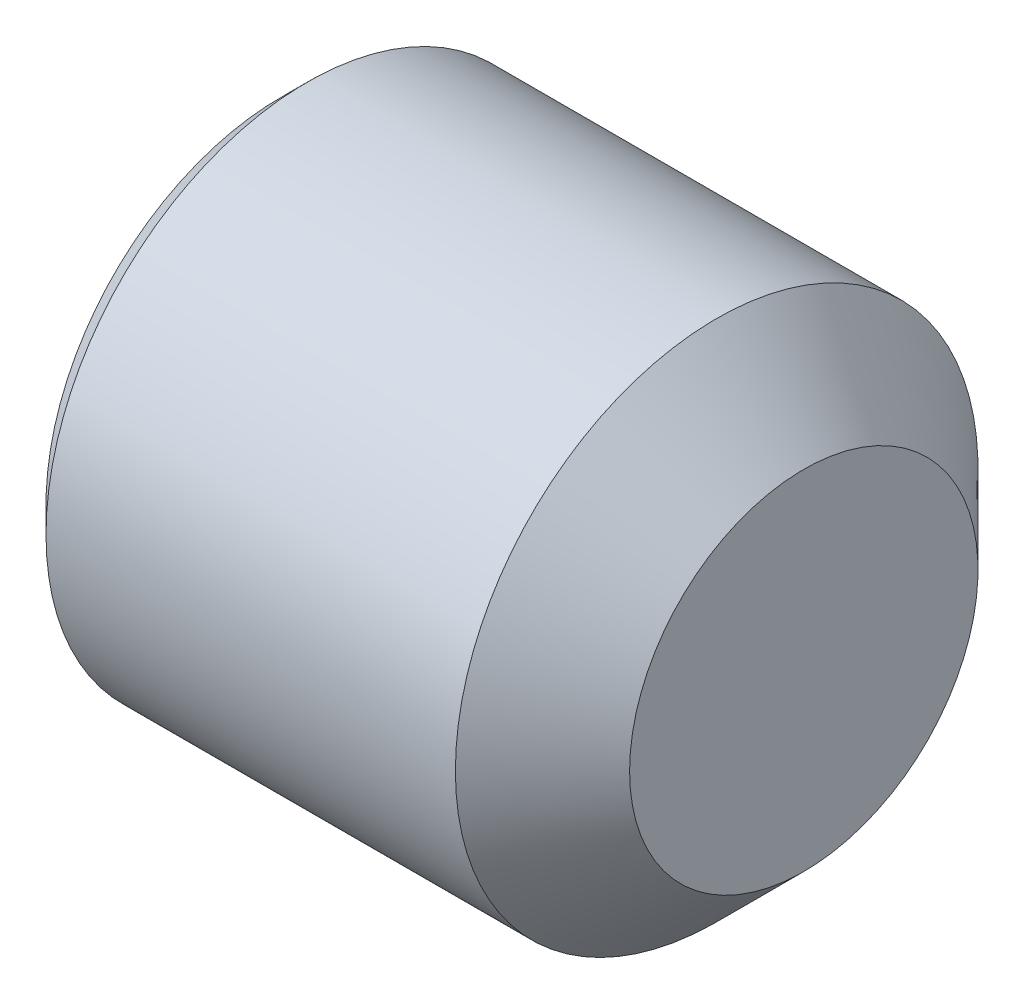
from build123d import *

# Parameters (mm, degrees)
CHAMFER1_SIZE      = 0.3
CUT_EXTRUDE1_DEPTH = 2


with BuildPart() as part:
    # Sketch1 → Revolve1 (revolve)
    with BuildSketch(Plane.XY, mode=Mode.PRIVATE) as revolve1_sk:
        Polygon((5, 3), (6, 2), (6, 0), (0, 0), (0, 3), align=None)
    revolve(revolve1_sk.sketch.rotate(Axis((0, 0, 0), (1, 0, 0)), 90), axis=Axis((0, 0, 0), (1, 0, 0)))

    # Chamfer1
    chamfer1_edges = [part.edges().sort_by_distance(p)[0] for p in [
        (0, 0, -3),
    ]]
    chamfer(chamfer1_edges, length=CHAMFER1_SIZE)

    # Sketch2 → Cut-Extrude1 (cut)
    with BuildSketch(Plane(origin=(0, 0, 0), x_dir=(0, 0, -1), z_dir=(1, 0, 0))):
        Polygon((0, 1.732050808), (-1.5, 0.866025404), (-1.5, -0.866025404), (0, -1.732050808), (1.5, -0.866025404), (1.5, 0.866025404), align=None)
    extrude(amount=CUT_EXTRUDE1_DEPTH, mode=Mode.SUBTRACT)

    # Sketch3 → Cut-Revolve1 (revolve, cut)
    with BuildSketch(Plane.XY, mode=Mode.PRIVATE) as cut_revolve1_sk:
        Polygon((2.866025404, 0), (2, 1.5), (2, 0), align=None)
    revolve(cut_revolve1_sk.sketch.rotate(Axis((2, 0, 0), (1, 0, 0)), 270), axis=Axis((2, 0, 0), (1, 0, 0)), mode=Mode.SUBTRACT)


solid = part.part
